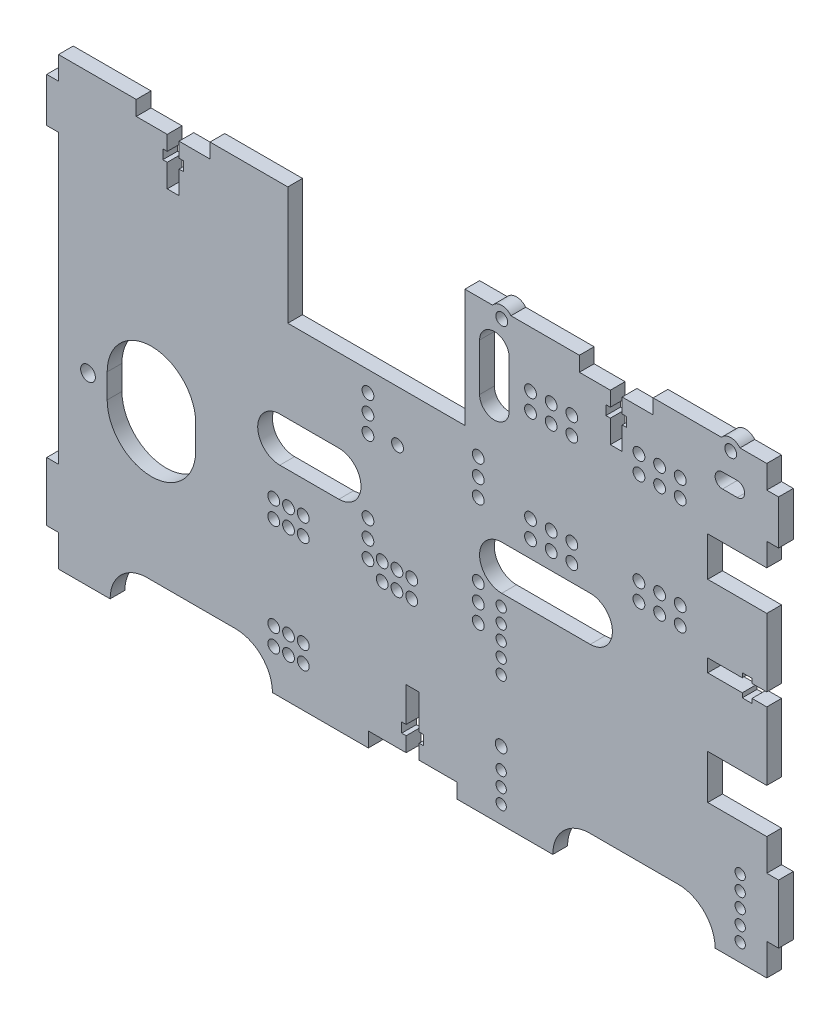
from build123d import *

# Parameters (mm, degrees)
SKETCH1_W           = 240
SKETCH1_H           = 151
BOSS_EXTRUDE1_DEPTH = 5
SKETCH2_W           = 60
SKETCH2_H           = 40
CUT_EXTRUDE1_DEPTH  = 5
SKETCH4_R           = 2
CUT_EXTRUDE3_DEPTH  = 5
SKETCH5_R           = 4
SKETCH5_R_2         = 2
BOSS_EXTRUDE2_DEPTH = 5
SKETCH13_R          = 2.5
CUT_EXTRUDE8_DEPTH  = 10
SKETCH16_W          = 4
SKETCH16_H          = 15
SKETCH16_H_2        = 20
BOSS_EXTRUDE5_DEPTH = 5
SKETCH24_R          = 2
CUT_EXTRUDE18_DEPTH = 10
SKETCH25_R          = 4
SKETCH25_R_2        = 2
BOSS_EXTRUDE7_DEPTH = 5
SKETCH26_W          = 20
SKETCH26_H          = 15
SKETCH26_H_2        = 13.35
CUT_EXTRUDE19_DEPTH = 10
CUT_EXTRUDE20_DEPTH = 10
CUT_EXTRUDE24_DEPTH = 5
SKETCH31_W          = 30
SKETCH31_H          = 5
CUT_EXTRUDE25_DEPTH = 5
CUT_EXTRUDE26_DEPTH = 5
CUT_EXTRUDE27_DEPTH = 5
CUT_EXTRUDE28_DEPTH = 10
CUT_EXTRUDE30_DEPTH = 10
CUT_EXTRUDE31_DEPTH = 10
SKETCH40_R          = 2
CUT_EXTRUDE32_DEPTH = 10
SKETCH37_R          = 1.75
CUT_EXTRUDE34_DEPTH = 5
SKETCH44_W          = 25
SKETCH44_H          = 5
CUT_EXTRUDE38_DEPTH = 10
CUT_EXTRUDE39_DEPTH = 5
SKETCH46_W          = 25
SKETCH46_H          = 5
CUT_EXTRUDE40_DEPTH = 10
CUT_EXTRUDE41_DEPTH = 10


with BuildPart() as part:
    # Sketch1 → Boss-Extrude1 (new body)
    with BuildSketch(Plane.XY):
        Rectangle(SKETCH1_W, SKETCH1_H)
    extrude(amount=BOSS_EXTRUDE1_DEPTH)

    # Sketch2 → Cut-Extrude1 (cut)
    with BuildSketch(Plane(origin=(0, 0, 0), x_dir=(-1, 0, 0), z_dir=(0, 0, -1))):
        with Locations((12.301489704, 55.5)):
            Rectangle(SKETCH2_W, SKETCH2_H)
    extrude(amount=-CUT_EXTRUDE1_DEPTH, mode=Mode.SUBTRACT)

    # Sketch4 → Cut-Extrude3 (cut)
    with BuildSketch(Plane(origin=(0, 0, 0), x_dir=(-1, 0, 0), z_dir=(0, 0, -1))):
        with Locations((-107.8, 73)):
            Circle(SKETCH4_R)
        with Locations((-30.2, 73)):
            Circle(SKETCH4_R)
    extrude(amount=-CUT_EXTRUDE3_DEPTH, mode=Mode.SUBTRACT)

    # Sketch5 → Boss-Extrude2 (add)
    # profile 1 of 2: a face of its own
    with BuildSketch(Plane(origin=(0, 0, 0), x_dir=(-1, 0, 0), z_dir=(0, 0, -1))):
        with Locations((-30.2, 73)):
            Circle(SKETCH5_R)
        with Locations((-30.2, 73)):
            Circle(SKETCH5_R_2, mode=Mode.SUBTRACT)
    # profile 2 of 2: a face of its own
    with BuildSketch(Plane(origin=(0, 0, 0), x_dir=(-1, 0, 0), z_dir=(0, 0, -1))):
        with Locations((-107.8, 73)):
            Circle(SKETCH5_R)
        with Locations((-107.8, 73)):
            Circle(SKETCH5_R_2, mode=Mode.SUBTRACT)
    extrude(amount=-BOSS_EXTRUDE2_DEPTH)

    # Sketch13 → Cut-Extrude8 (cut)
    with BuildSketch(Plane(origin=(0, 0, 0), x_dir=(-1, 0, 0), z_dir=(0, 0, -1))):
        with Locations((110, -13)):
            Circle(SKETCH13_R)
    extrude(amount=-CUT_EXTRUDE8_DEPTH, mode=Mode.SUBTRACT)

    # Sketch16 → Boss-Extrude5 (add)
    with BuildSketch(Plane(origin=(0, 0, 0), x_dir=(-1, 0, 0), z_dir=(0, 0, -1))):
        with Locations((-122, 60.175)):
            Rectangle(SKETCH16_W, SKETCH16_H)
        with Locations((-122, -54.75)):
            Rectangle(SKETCH16_W, SKETCH16_H_2)
        with Locations((122, -54.75)):
            Rectangle(SKETCH16_W, SKETCH16_H_2)
        with Locations((122, 60.175)):
            Rectangle(SKETCH16_W, SKETCH16_H)
    extrude(amount=-BOSS_EXTRUDE5_DEPTH)

    # Sketch24 → Cut-Extrude18 (cut)
    with BuildSketch(Plane(origin=(0, 0, 0), x_dir=(-1, 0, 0), z_dir=(0, 0, -1))):
        with Locations((-30, -52.5)):
            Circle(SKETCH24_R)
        with Locations((5.115159436, 18.266698226)):
            Circle(SKETCH24_R)
    extrude(amount=-CUT_EXTRUDE18_DEPTH, mode=Mode.SUBTRACT)

    # Sketch25 → Boss-Extrude7 (add)
    with BuildSketch(Plane(origin=(0, 0, 0), x_dir=(-1, 0, 0), z_dir=(0, 0, -1))):
        with Locations((-30, -52.5)):
            Circle(SKETCH25_R)
        with Locations((-30, -52.5)):
            Circle(SKETCH25_R_2, mode=Mode.SUBTRACT)
    extrude(amount=-BOSS_EXTRUDE7_DEPTH)

    # Sketch26 → Cut-Extrude19 (cut)
    with BuildSketch(Plane(origin=(0, 0, 0), x_dir=(-1, 0, 0), z_dir=(0, 0, -1))):
        with Locations((-110, -26.5)):
            Rectangle(SKETCH26_W, SKETCH26_H)
        with Locations((-110, 38.175)):
            Rectangle(SKETCH26_W, SKETCH26_H_2)
    extrude(amount=-CUT_EXTRUDE19_DEPTH, mode=Mode.SUBTRACT)

    # Sketch27 → Cut-Extrude20 (cut)
    with BuildSketch(Plane(origin=(0, 0, 0), x_dir=(-1, 0, 0), z_dir=(0, 0, -1))):
        Polygon((-120, 8.45), (-115, 8.45), (-115, 9.95), (-111.7, 9.95), (-111.7, 8.45), (-100, 8.45), (-100, 4.05), (-111.7, 4.05), (-111.7, 2.55), (-115, 2.55), (-115, 4.05), (-120, 4.05), align=None)
    extrude(amount=-CUT_EXTRUDE20_DEPTH, mode=Mode.SUBTRACT)

    # Sketch29 → Cut-Extrude24 (cut)
    with BuildSketch(Plane(origin=(0, 0, 0), x_dir=(-1, 0, 0), z_dir=(0, 0, -1))):
        with BuildLine():
            Line((60, -63), (90, -63))
            ThreePointArc((90, -63), (102.5, -75.5), (90, -88))
            Line((90, -88), (60, -88))
            ThreePointArc((60, -88), (47.5, -75.5), (60, -63))
        make_face()
        with BuildLine():
            Line((-90, -63), (-60, -63))
            ThreePointArc((-60, -63), (-47.5, -75.5), (-60, -88))
            Line((-60, -88), (-90, -88))
            ThreePointArc((-90, -88), (-102.5, -75.5), (-90, -63))
        make_face()
    extrude(amount=-CUT_EXTRUDE24_DEPTH, mode=Mode.SUBTRACT)

    # Sketch31 → Cut-Extrude25 (cut)
    with BuildSketch(Plane(origin=(0, 0, 0), x_dir=(-1, 0, 0), z_dir=(0, 0, -1))):
        with Locations((0, -73)):
            Rectangle(SKETCH31_W, SKETCH31_H)
    extrude(amount=-CUT_EXTRUDE25_DEPTH, mode=Mode.SUBTRACT)

    # Sketch32 → Cut-Extrude26 (cut)
    with BuildSketch(Plane(origin=(0, 0, 0), x_dir=(-1, 0, 0), z_dir=(0, 0, -1))):
        Polygon((-2.2, -50.5), (-2.2, -62.2), (-3.7, -62.2), (-3.7, -65.5), (-2.2, -65.5), (-2.2, -70.5), (2.2, -70.5), (2.2, -65.5), (3.7, -65.5), (3.7, -62.2), (2.2, -62.2), (2.2, -50.5), align=None)
    extrude(amount=-CUT_EXTRUDE26_DEPTH, mode=Mode.SUBTRACT)

    # Sketch34 → Cut-Extrude27 (cut)
    with BuildSketch(Plane(origin=(0, 0, 0), x_dir=(-1, 0, 0), z_dir=(0, 0, -1))):
        with BuildLine():
            Line((73.5, -17.623043916), (73.5, -9.376956084))
            ThreePointArc((73.5, -9.376956084), (88.5, 5.623043916), (103.5, -9.376956084))
            Line((103.5, -9.376956084), (103.5, -17.623043916))
            ThreePointArc((103.5, -17.623043916), (88.5, -32.623043916), (73.5, -17.623043916))
        make_face()
    extrude(amount=-CUT_EXTRUDE27_DEPTH, mode=Mode.SUBTRACT)

    # Sketch35 → Cut-Extrude28 (cut)
    with BuildSketch(Plane(origin=(0, 0, 0), x_dir=(-1, 0, 0), z_dir=(0, 0, -1))):
        with BuildLine():
            Line((-22.698510296, 63.072196594), (-22.698510296, 47.072196594))
            ThreePointArc((-22.698510296, 47.072196594), (-27.698510296, 42.072196594), (-32.698510296, 47.072196594))
            Line((-32.698510296, 47.072196594), (-32.698510296, 63.072196594))
            ThreePointArc((-32.698510296, 63.072196594), (-27.698510296, 68.072196594), (-22.698510296, 63.072196594))
        make_face()
    extrude(amount=-CUT_EXTRUDE28_DEPTH, mode=Mode.SUBTRACT)

    # Sketch38 → Cut-Extrude30 (cut)
    with BuildSketch(Plane(origin=(0, 0, 0), x_dir=(-1, 0, 0), z_dir=(0, 0, -1))):
        with BuildLine():
            Line((45, -7.5), (25, -7.5))
            ThreePointArc((25, -7.5), (17.5, 0), (25, 7.5))
            Line((25, 7.5), (45, 7.5))
            ThreePointArc((45, 7.5), (52.5, 0), (45, -7.5))
        make_face()
        with BuildLine():
            Line((-60.189404258, 7.5), (-30.189404258, 7.5))
            ThreePointArc((-30.189404258, 7.5), (-22.689404258, 0), (-30.189404258, -7.5))
            Line((-30.189404258, -7.5), (-60.189404258, -7.5))
            ThreePointArc((-60.189404258, -7.5), (-67.689404258, 0), (-60.189404258, 7.5))
        make_face()
    extrude(amount=-CUT_EXTRUDE30_DEPTH, mode=Mode.SUBTRACT)

    # Sketch39 → Cut-Extrude31 (cut)
    with BuildSketch(Plane(origin=(0, 0, 0), x_dir=(-1, 0, 0), z_dir=(0, 0, -1))):
        with BuildLine():
            Line((-110, 65.5), (-105, 65.5))
            ThreePointArc((-105, 65.5), (-102.5, 63), (-105, 60.5))
            Line((-105, 60.5), (-110, 60.5))
            ThreePointArc((-110, 60.5), (-112.5, 63), (-110, 65.5))
        make_face()
    extrude(amount=-CUT_EXTRUDE31_DEPTH, mode=Mode.SUBTRACT)

    # Sketch40 → Cut-Extrude32 (cut)
    with BuildSketch(Plane(origin=(0, 0, 0), x_dir=(-1, 0, 0), z_dir=(0, 0, -1))):
        with Locations((-46.94391141, 56.63631327)):
            Circle(SKETCH40_R)
        with Locations((-83.68571173, 19.25681239)):
            Circle(SKETCH40_R)
        with Locations((-46.94391141, 19.25681239)):
            Circle(SKETCH40_R)
        with Locations((-83.68571173, 56.63631327)):
            Circle(SKETCH40_R)
        with Locations((-53.94391141, 56.63631327)):
            Circle(SKETCH40_R)
        with Locations((-90.68571173, 19.25681239)):
            Circle(SKETCH40_R)
        with Locations((-53.94391141, 19.25681239)):
            Circle(SKETCH40_R)
        with Locations((-90.68571173, 56.63631327)):
            Circle(SKETCH40_R)
        with Locations((-46.94391141, 50.63631327)):
            Circle(SKETCH40_R)
        with Locations((-83.68571173, 13.25681239)):
            Circle(SKETCH40_R)
        with Locations((-46.94391141, 13.25681239)):
            Circle(SKETCH40_R)
        with Locations((-83.68571173, 50.63631327)):
            Circle(SKETCH40_R)
        with Locations((-53.94391141, 50.63631327)):
            Circle(SKETCH40_R)
        with Locations((-90.68571173, 13.25681239)):
            Circle(SKETCH40_R)
        with Locations((-53.94391141, 13.25681239)):
            Circle(SKETCH40_R)
        with Locations((-90.68571173, 50.63631327)):
            Circle(SKETCH40_R)
        with Locations((-39.94391141, 50.63631327)):
            Circle(SKETCH40_R)
        with Locations((-76.68571173, 13.25681239)):
            Circle(SKETCH40_R)
        with Locations((-39.94391141, 13.25681239)):
            Circle(SKETCH40_R)
        with Locations((-76.68571173, 50.63631327)):
            Circle(SKETCH40_R)
        with Locations((-22.24318761, 22.59428252)):
            Circle(SKETCH40_R)
        with Locations((15.13631327, 22.59428252)):
            Circle(SKETCH40_R)
        with Locations((-76.68571173, 56.63631327)):
            Circle(SKETCH40_R)
        with Locations((-39.94391141, 56.63631327)):
            Circle(SKETCH40_R)
        with Locations((-22.24318761, 28.59428252)):
            Circle(SKETCH40_R)
        with Locations((-39.94391141, 19.25681239)):
            Circle(SKETCH40_R)
        with Locations((15.13631327, 28.59428252)):
            Circle(SKETCH40_R)
        with Locations((15.13631327, -8.1475178)):
            Circle(SKETCH40_R)
        with Locations((37.05608859, -18.36368673)):
            Circle(SKETCH40_R)
        with Locations((0.31428827, -18.36368673)):
            Circle(SKETCH40_R)
        with Locations((-76.68571173, 19.25681239)):
            Circle(SKETCH40_R)
        with Locations((-22.24318761, -8.1475178)):
            Circle(SKETCH40_R)
        with Locations((37.05608859, -55.74318761)):
            Circle(SKETCH40_R)
        with Locations((15.13631327, -14.1475178)):
            Circle(SKETCH40_R)
        with Locations((-22.24318761, -14.1475178)):
            Circle(SKETCH40_R)
        with Locations((-22.24318761, 16.59428252)):
            Circle(SKETCH40_R)
        with Locations((15.13631327, 16.59428252)):
            Circle(SKETCH40_R)
        with Locations((15.13631327, -20.1475178)):
            Circle(SKETCH40_R)
        with Locations((-22.24318761, -20.1475178)):
            Circle(SKETCH40_R)
        with Locations((42.05608859, -18.36368673)):
            Circle(SKETCH40_R)
        with Locations((42.05608859, -55.74318761)):
            Circle(SKETCH40_R)
        with Locations((5.31428827, -18.36368673)):
            Circle(SKETCH40_R)
        with Locations((47.05608859, -18.36368673)):
            Circle(SKETCH40_R)
        with Locations((47.05608859, -55.74318761)):
            Circle(SKETCH40_R)
        with Locations((10.31428827, -18.36368673)):
            Circle(SKETCH40_R)
        with Locations((42.05608859, -24.36368673)):
            Circle(SKETCH40_R)
        with Locations((42.05608859, -61.74318761)):
            Circle(SKETCH40_R)
        with Locations((5.31428827, -24.36368673)):
            Circle(SKETCH40_R)
        with Locations((47.05608859, -24.36368673)):
            Circle(SKETCH40_R)
        with Locations((47.05608859, -61.74318761)):
            Circle(SKETCH40_R)
        with Locations((10.31428827, -24.36368673)):
            Circle(SKETCH40_R)
        with Locations((37.05608859, -24.36368673)):
            Circle(SKETCH40_R)
        with Locations((37.05608859, -61.74318761)):
            Circle(SKETCH40_R)
        with Locations((0.31428827, -24.36368673)):
            Circle(SKETCH40_R)
    extrude(amount=-CUT_EXTRUDE32_DEPTH, mode=Mode.SUBTRACT)

    # Sketch37 → Cut-Extrude34 (cut)
    with BuildSketch(Plane(origin=(0, 0, 0), x_dir=(-1, 0, 0), z_dir=(0, 0, -1))):
        with Locations((-111, -59.5)):
            Circle(SKETCH37_R)
        with Locations((-30, -59.5)):
            Circle(SKETCH37_R)
        with Locations((-30, -21.5)):
            Circle(SKETCH37_R)
        with Locations((-30, -16.5)):
            Circle(SKETCH37_R)
        with Locations((-111, -54.5)):
            Circle(SKETCH37_R)
        with Locations((-30, -11.5)):
            Circle(SKETCH37_R)
        with Locations((-111, -49.5)):
            Circle(SKETCH37_R)
        with Locations((-111, -64.5)):
            Circle(SKETCH37_R)
        with Locations((-30, -64.5)):
            Circle(SKETCH37_R)
        with Locations((-30, -26.5)):
            Circle(SKETCH37_R)
        with Locations((-111, -69.5)):
            Circle(SKETCH37_R)
        with Locations((-30, -69.5)):
            Circle(SKETCH37_R)
        with Locations((-30, -31.5)):
            Circle(SKETCH37_R)
    extrude(amount=-CUT_EXTRUDE34_DEPTH, mode=Mode.SUBTRACT)

    # Sketch44 → Cut-Extrude38 (cut)
    with BuildSketch(Plane(origin=(0, 0, 0), x_dir=(-1, 0, 0), z_dir=(0, 0, -1))):
        with Locations((-69, 73)):
            Rectangle(SKETCH44_W, SKETCH44_H)
    extrude(amount=-CUT_EXTRUDE38_DEPTH, mode=Mode.SUBTRACT)

    # Sketch45 → Cut-Extrude39 (cut)
    with BuildSketch(Plane(origin=(0, 0, 0), x_dir=(-1, 0, 0), z_dir=(0, 0, -1))):
        Polygon((-67, 70.5), (-71, 70.5), (-71, 65.5), (-72.5, 65.5), (-72.5, 62.3), (-71, 62.3), (-71, 54.5), (-67, 54.5), (-67, 62.3), (-65.5, 62.3), (-65.5, 65.5), (-67, 65.5), align=None)
    extrude(amount=-CUT_EXTRUDE39_DEPTH, mode=Mode.SUBTRACT)

    # Sketch46 → Cut-Extrude40 (cut)
    with BuildSketch(Plane(origin=(0, 0, 0), x_dir=(-1, 0, 0), z_dir=(0, 0, -1))):
        with Locations((81.151489704, 73)):
            Rectangle(SKETCH46_W, SKETCH46_H)
    extrude(amount=-CUT_EXTRUDE40_DEPTH, mode=Mode.SUBTRACT)

    # Sketch47 → Cut-Extrude41 (cut)
    with BuildSketch(Plane(origin=(0, 0, 0), x_dir=(-1, 0, 0), z_dir=(0, 0, -1))):
        Polygon((83.151489704, 70.5), (79.151489704, 70.5), (79.151489704, 65.5), (77.651489704, 65.5), (77.651489704, 62.3), (79.151489704, 62.3), (79.151489704, 54.5), (83.151489704, 54.5), (83.151489704, 62.3), (84.651489704, 62.3), (84.651489704, 65.5), (83.151489704, 65.5), align=None)
    extrude(amount=-CUT_EXTRUDE41_DEPTH, mode=Mode.SUBTRACT)


solid = part.part
